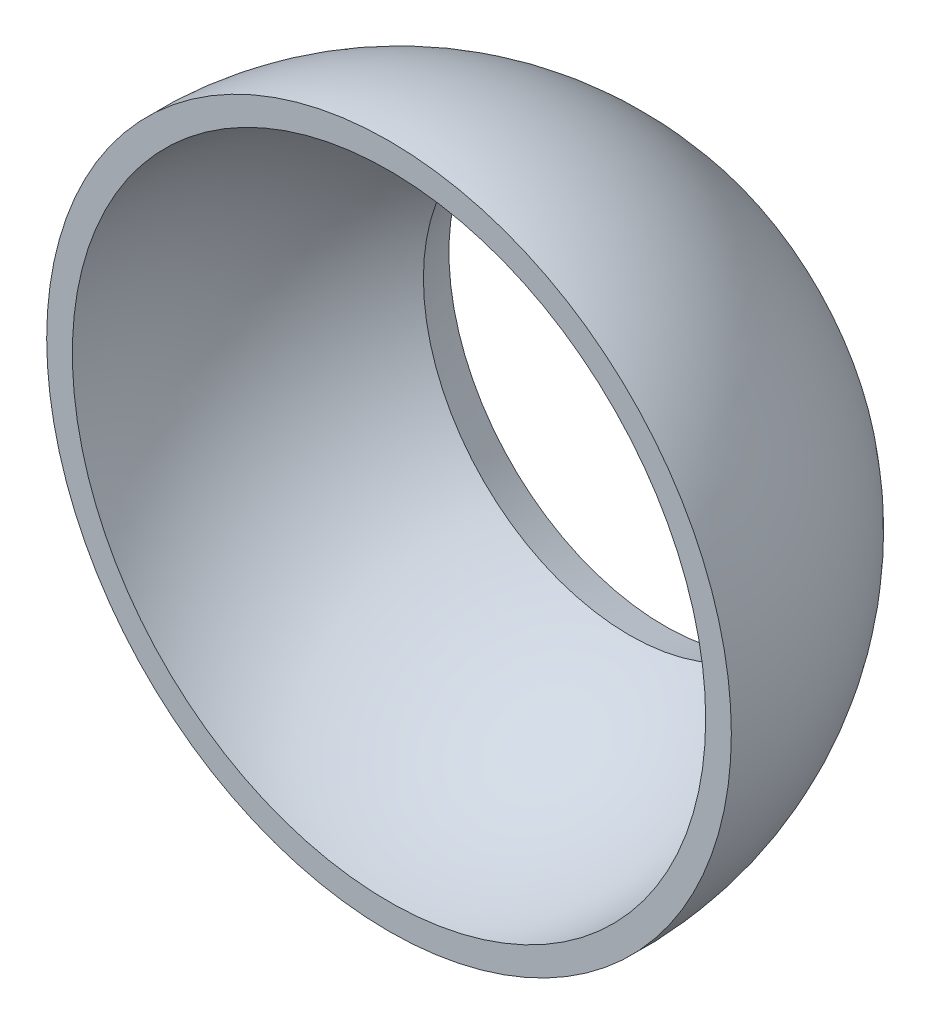
from build123d import *


with BuildPart() as part:
    # 草图2 → 旋转1 (revolve)
    with BuildSketch(Plane(origin=(0, 0, 0), x_dir=(1, 0, 0), z_dir=(0, 1, 0))):
        with BuildLine():
            Line((7.155, -41.417787665), (6.82423803, -42.594050982))
            ThreePointArc((6.82423803, -42.594050982), (9.527557542, -46.17457426), (10.487206926, -50.557171251))
            Line((10.487206926, -50.557171251), (11.336636736, -50.557171251))
            ThreePointArc((11.336636736, -50.557171251), (10.31344949, -45.498995145), (7.155, -41.417787665))
        make_face()
    revolve(axis=Axis((0, 0, 0), (0, 0, -1)))


solid = part.part
